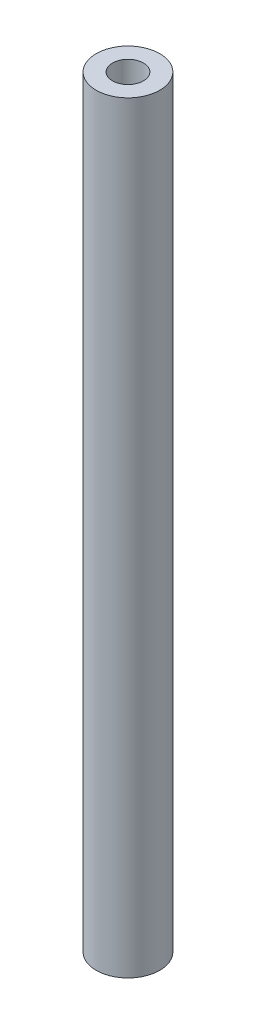
from build123d import *

# Parameters (mm, degrees)
SKETCH1_R           = 1.5875
SKETCH1_R_2         = 0.7747
BOSS_EXTRUDE1_DEPTH = 38.1


with BuildPart() as part:
    # Sketch1 → Boss-Extrude1 (new body)
    with BuildSketch(Plane(origin=(0, 0, 0), x_dir=(1, 0, 0), z_dir=(0, 1, 0))):
        with Locations(Location((0, 0, 0), (0, 0, 270))):
            Circle(SKETCH1_R)
        with Locations(Location((0, 0, 0), (0, 0, 270))):
            Circle(SKETCH1_R_2, mode=Mode.SUBTRACT)
    extrude(amount=-BOSS_EXTRUDE1_DEPTH)


solid = part.part
